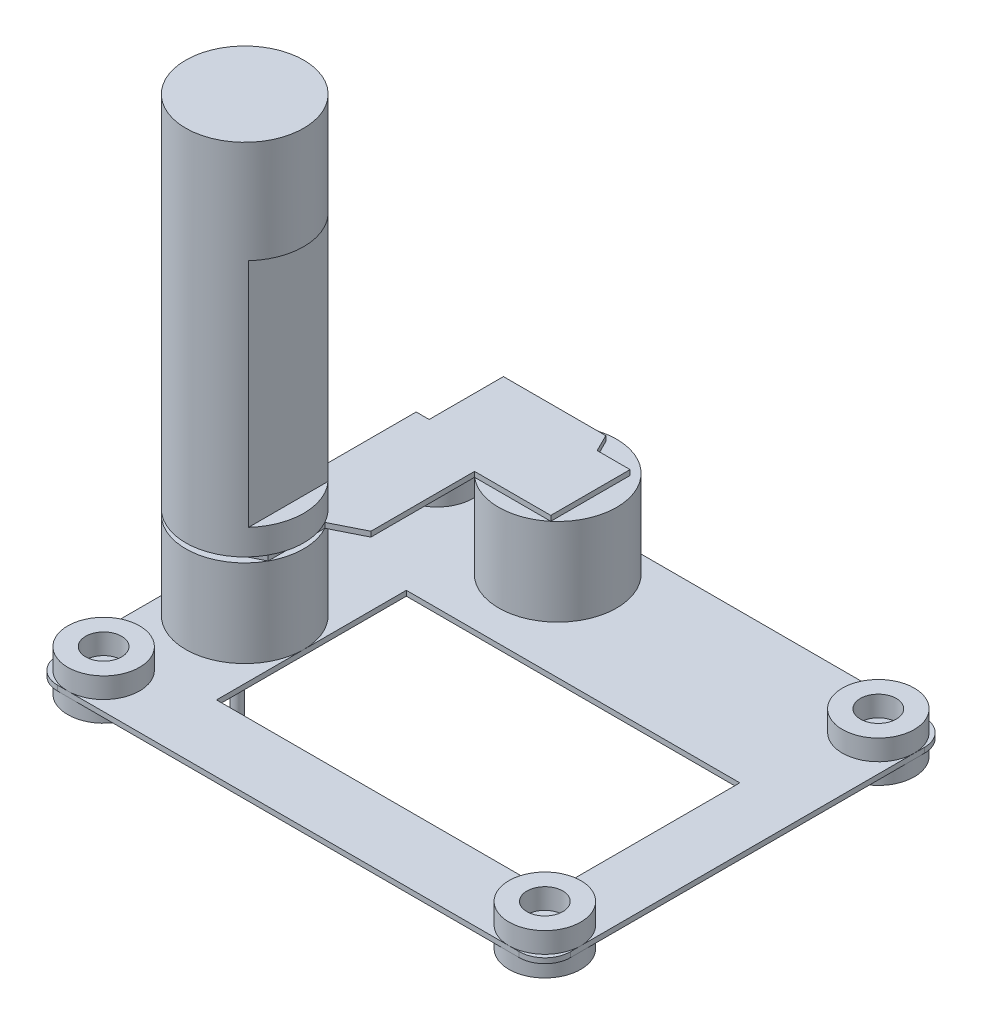
from build123d import *

# Parameters (mm, degrees)
ESQUISSE4_W             = 100
ESQUISSE4_H             = 79
BOSS_EXTRU_3_DEPTH      = 1
BOSS_EXTRU_4_DEPTH      = 4
BOSS_EXTRU_4_DEPTH_BACK = 4
ESQUISSE1_R             = 7
ESQUISSE1_R_2           = 3.5
ESQUISSE6_R             = 11.5
BOSS_EXTRU_5_DEPTH      = 17
BOSS_EXTRU_6_DEPTH      = 1
ESQUISSE8_W             = 65
ESQUISSE8_H             = 37
ENL_V_MAT_EXTRU_1_DEPTH = 1
ESQUISSE9_R             = 1
BOSS_EXTRU_7_DEPTH      = 18
ESQUISSE10_R            = 11.5
BOSS_EXTRU_8_DEPTH      = 50
CONG_2_R                = 5
ENL_V_START             = -45
ENL_V_MAT_EXTRU_3_DEPTH = 45
ESQUISSE12_R            = 11.5
BOSS_EXTRU_9_DEPTH      = 20


with BuildPart() as part:
    # Esquisse4 → Boss.-Extru.3 (new body)
    with BuildSketch(Plane(origin=(0, 0, 0), x_dir=(1, 0, 0), z_dir=(0, 1, 0))):
        Rectangle(ESQUISSE4_W, ESQUISSE4_H)
    extrude(amount=-BOSS_EXTRU_3_DEPTH)

    # Esquisse1 → Boss.-Extru.4 (add, two sides: drawn at the far end of the back side and taken through both)
    # profile 1 of 4: a face of its own
    with BuildSketch(Plane(origin=(0, 0, 0), x_dir=(1, 0, 0), z_dir=(0, 1, 0)).offset(-BOSS_EXTRU_4_DEPTH_BACK)):
        with Locations((-43, -32.5)):
            Circle(ESQUISSE1_R)
        with Locations((-43, -32.5)):
            Circle(ESQUISSE1_R_2, mode=Mode.SUBTRACT)
    # profile 2 of 4: a face of its own
    with BuildSketch(Plane(origin=(0, 0, 0), x_dir=(1, 0, 0), z_dir=(0, 1, 0)).offset(-BOSS_EXTRU_4_DEPTH_BACK)):
        with Locations((43, -32.5)):
            Circle(ESQUISSE1_R)
        with Locations((43, -32.5)):
            Circle(ESQUISSE1_R_2, mode=Mode.SUBTRACT)
    # profile 3 of 4: a face of its own
    with BuildSketch(Plane(origin=(0, 0, 0), x_dir=(1, 0, 0), z_dir=(0, 1, 0)).offset(-BOSS_EXTRU_4_DEPTH_BACK)):
        with Locations((-43, 32.5)):
            Circle(ESQUISSE1_R)
        with Locations((-43, 32.5)):
            Circle(ESQUISSE1_R_2, mode=Mode.SUBTRACT)
    # profile 4 of 4: a face of its own
    with BuildSketch(Plane(origin=(0, 0, 0), x_dir=(1, 0, 0), z_dir=(0, 1, 0)).offset(-BOSS_EXTRU_4_DEPTH_BACK)):
        with Locations((43, 32.5)):
            Circle(ESQUISSE1_R)
        with Locations((43, 32.5)):
            Circle(ESQUISSE1_R_2, mode=Mode.SUBTRACT)
    extrude(amount=BOSS_EXTRU_4_DEPTH + BOSS_EXTRU_4_DEPTH_BACK)

    # Esquisse6 → Boss.-Extru.5 (add)
    with BuildSketch(Plane(origin=(0, 0, 0), x_dir=(1, 0, 0), z_dir=(0, 1, 0))):
        with Locations((-38.5, -9.5)):
            Circle(ESQUISSE6_R)
        with Locations((-15, 28)):
            Circle(ESQUISSE6_R)
    extrude(amount=BOSS_EXTRU_5_DEPTH)

    # Esquisse7 → Boss.-Extru.6 (add)
    with BuildSketch(Plane(origin=(0, 17, 0), x_dir=(1, 0, 0), z_dir=(0, 1, 0))):
        Polygon((-38.143774149, -19.88751618), (-28.414215556, -15.025120102), (-28.414215556, -3.974879898), (-22.428299765, -0.98338823), (-22.428299765, 19.221027247), (-7.571700235, 19.221027247), (-7.571700235, 34.680148422), (-13.988712335, 34.680148422), (-15.667356388, 38.039082045), (-35.613243864, 38.039082045), (-35.613243864, 23.559466539), (-38.143774149, 23.559466539), (-38.143774149, 0), align=None)
    extrude(amount=BOSS_EXTRU_6_DEPTH)

    # Esquisse8 → Enlèv. mat.-Extru.1 (cut)
    with BuildSketch(Plane(origin=(0, 0, 0), x_dir=(1, 0, 0), z_dir=(0, 1, 0))):
        with Locations((5.5, -8)):
            Rectangle(ESQUISSE8_W, ESQUISSE8_H)
    extrude(amount=-ENL_V_MAT_EXTRU_1_DEPTH, mode=Mode.SUBTRACT)

    # Esquisse9 → Boss.-Extru.7 (add)
    with BuildSketch(Plane.XZ.offset(1)):
        with Locations((-40, 9.5)):
            Circle(ESQUISSE9_R)
    extrude(amount=BOSS_EXTRU_7_DEPTH)

    # Esquisse10 → Boss.-Extru.8 (add)
    with BuildSketch(Plane(origin=(0, 18, 0), x_dir=(1, 0, 0), z_dir=(0, 1, 0))):
        with Locations((-38.5, -9.5)):
            Circle(ESQUISSE10_R)
    extrude(amount=BOSS_EXTRU_8_DEPTH)

    # Congé2
    cong_2_edges = [part.edges().sort_by_distance(p)[0] for p in [
        (-50, -0.5, 39.5),
        (50, -0.5, 39.5),
        (50, -0.5, -39.5),
        (-50, -0.5, -39.5),
    ]]
    fillet(cong_2_edges, radius=CONG_2_R)

    # Esquisse11 → Enlèv. mat.-Extru.3 (cut)
    with BuildSketch(Plane(origin=(0, 68, 0), x_dir=(1, 0, 0), z_dir=(0, 1, 0)).offset(ENL_V_START)):
        with BuildLine():
            Line((-30, -17.245966692), (-30, -1.754033308))
            ThreePointArc((-30, -1.754033308), (-27, -9.5), (-30, -17.245966692))
        make_face()
    extrude(amount=ENL_V_MAT_EXTRU_3_DEPTH, mode=Mode.SUBTRACT)

    # Esquisse12 → Boss.-Extru.9 (add)
    with BuildSketch(Plane(origin=(0, 68, 0), x_dir=(1, 0, 0), z_dir=(0, 1, 0))):
        with Locations((-38.5, -9.5)):
            Circle(ESQUISSE12_R)
    extrude(amount=BOSS_EXTRU_9_DEPTH)


solid = part.part
